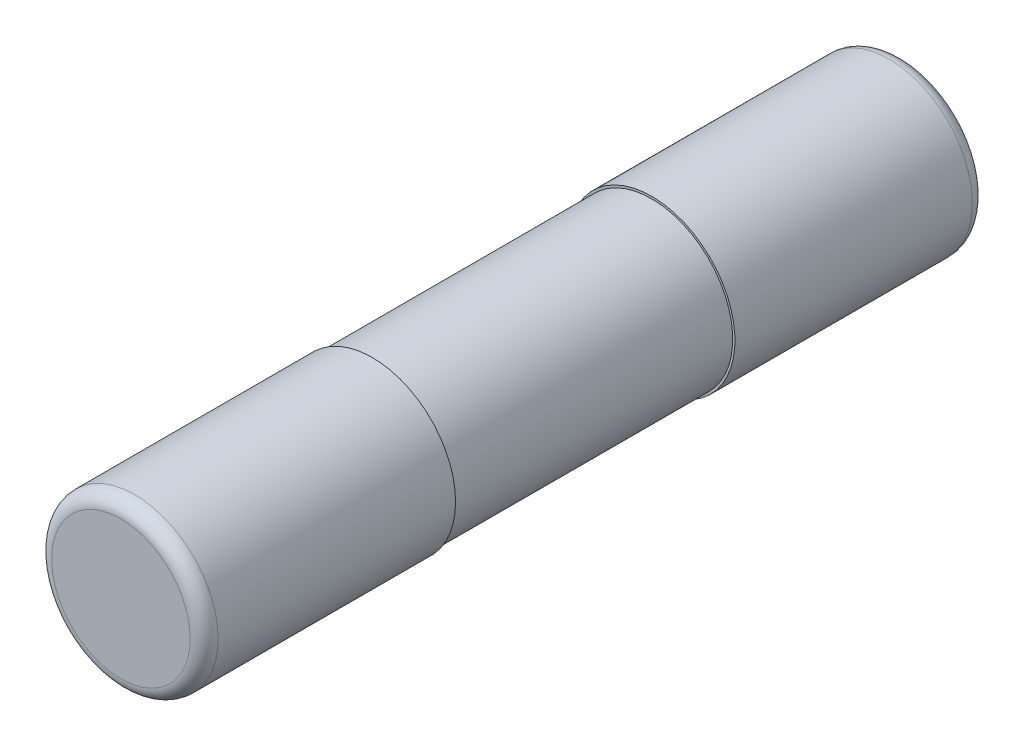
from build123d import *

# Parameters (mm, degrees)
SKETCH_1_R      = 1.45
EXTRUDE_1_DEPTH = 5
SKETCH_2_R      = 1.49
EXTRUDE_2_DEPTH = 4.5
EXTRUDE_START   = 4.5
SKETCH_5_R      = 1.49
EXTRUDE_3_DEPTH = 4.5
FILLET_1_R      = 0.25


with BuildPart() as part:
    # 스케치1 → 보스-돌출1 (new body)
    with BuildSketch(Plane.XY):
        Circle(SKETCH_1_R)
    extrude(amount=EXTRUDE_1_DEPTH)

    # 스케치2 → 보스-돌출2 (add)
    with BuildSketch(Plane.XY.offset(5)):
        Circle(SKETCH_2_R)
    extrude(amount=EXTRUDE_2_DEPTH)

    # 스케치5 → 보스-돌출3 (add)
    with BuildSketch(Plane(origin=(0, 0, 0), x_dir=(-1, 0, 0), z_dir=(0, 0, -1)).offset(EXTRUDE_START)):
        with Locations(Location((0, 0, 0), (0, 0, 180))):
            Circle(SKETCH_5_R)
    extrude(amount=-EXTRUDE_3_DEPTH)

    # 필렛1
    fillet_1_edges = [part.edges().sort_by_distance(p)[0] for p in [
        (-1.49, 0, -4.5),
        (-1.49, 0, 9.5),
    ]]
    fillet(fillet_1_edges, radius=FILLET_1_R)


solid = part.part
